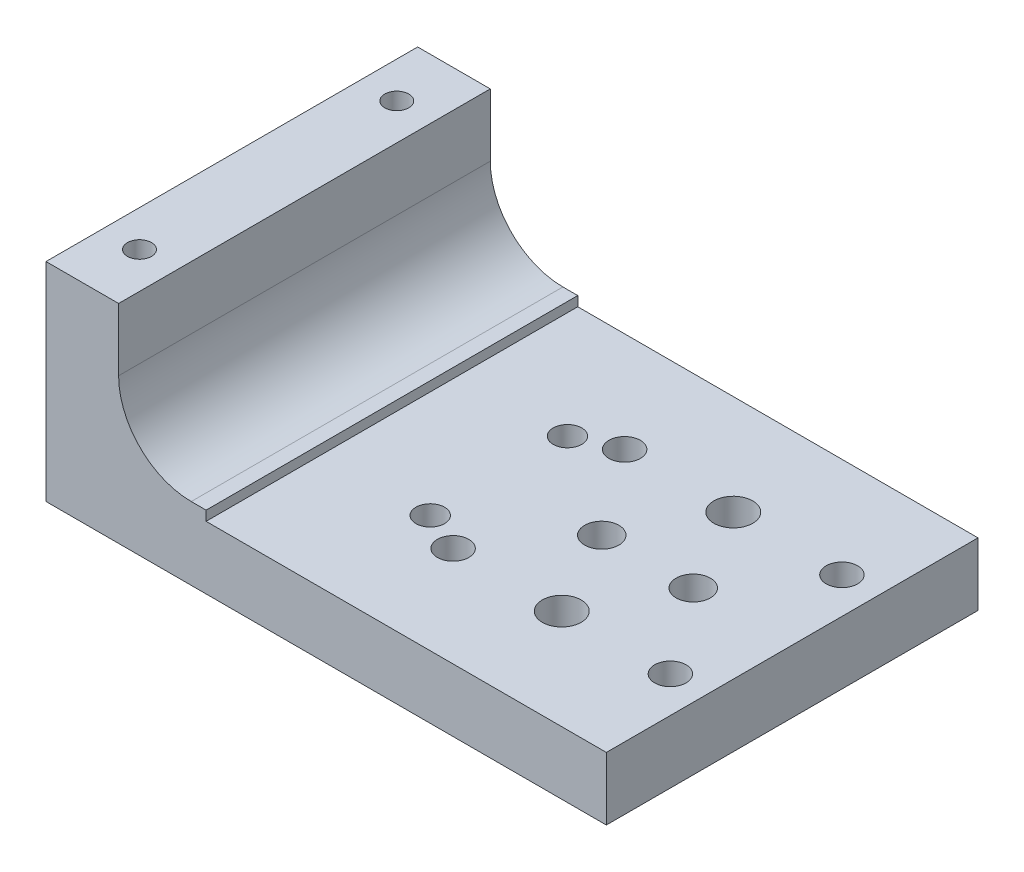
from build123d import *

# Parameters (mm, degrees)
EXTRUDE1_DEPTH            = 32.5
SKETCH2_W                 = 70
SKETCH2_H                 = 1.7
CUT_EXTRUDE1_DEPTH        = 124.086646311
M5_CLEARANCE_HOLE1_D      = 5.5
M5X0_8_TAPPED_HOLE1_D     = 4.2
M5X0_8_TAPPED_HOLE1_DEPTH = 19.05
M5X0_8_TAPPED_HOLE1_TIP   = 1.2618073
F_5_0_5_DIAMETER_HOLE1_D  = 5
M8X1_25_TAPPED_HOLE1_D    = 6.8
F_6_0_6_DIAMETER_HOLE1_D  = 6


with BuildPart() as part:
    # Sketch1 → Extrude1 (new, symmetric)
    with BuildSketch(Plane.XY):
        with BuildLine():
            Line((0, 0), (98, 0))
            Line((98, 0), (98, 12.7))
            Line((98, 12.7), (25.4, 12.7))
            ThreePointArc((25.4, 12.7), (16.419743879, 16.419743879), (12.7, 25.4))
            Line((12.7, 25.4), (12.7, 36.35))
            Line((12.7, 36.35), (0, 36.35))
            Line((0, 36.35), (0, 0))
        make_face()
    extrude(amount=EXTRUDE1_DEPTH, both=True)

    # Sketch2 → Cut-Extrude1 (cut, through all)
    with BuildSketch(Plane(origin=(0, 0, -32.5), x_dir=(-1, 0, 0), z_dir=(0, 0, -1))):
        with Locations((-63, 11.85)):
            Rectangle(SKETCH2_W, SKETCH2_H)
    extrude(amount=-CUT_EXTRUDE1_DEPTH, mode=Mode.SUBTRACT)

    # M5 Clearance Hole1 (through all)
    with Locations(Plane.XZ):
        with Locations((53.7, 15), (91.7, 15), (91.7, -15), (53.7, -15)):
            Hole(M5_CLEARANCE_HOLE1_D / 2)

    # M5x0.8 Tapped Hole1
    with Locations(Plane(origin=(0, 36.35, 0), x_dir=(-1, 0, 0), z_dir=(0, 1, 0))):
        with Locations((-6.35, 22.5), (-6.35, -22.5)):
            Hole(M5X0_8_TAPPED_HOLE1_D / 2, depth=M5X0_8_TAPPED_HOLE1_DEPTH)
            with Locations((0, 0, -(M5X0_8_TAPPED_HOLE1_DEPTH + M5X0_8_TAPPED_HOLE1_TIP / 2))):  # 118° drill point
                Cone(0, M5X0_8_TAPPED_HOLE1_D / 2, M5X0_8_TAPPED_HOLE1_TIP, mode=Mode.SUBTRACT)

    # Ø5.0 (5) Diameter Hole1 (through all)
    with Locations(Plane.XZ):
        with Locations((46.70001183, 12), (46.70001183, -12)):
            Hole(F_5_0_5_DIAMETER_HOLE1_D / 2)

    # M8x1.25 Tapped Hole1 (through all)
    with Locations(Plane.XZ):
        with Locations((72.7, -15), (72.7, 15)):
            Hole(M8X1_25_TAPPED_HOLE1_D / 2)

    # Ø6.0 (6) Diameter Hole1 (through all)
    with Locations(Plane.XZ):
        with Locations((64.7, 0), (80.7, 0)):
            Hole(F_6_0_6_DIAMETER_HOLE1_D / 2)


solid = part.part
